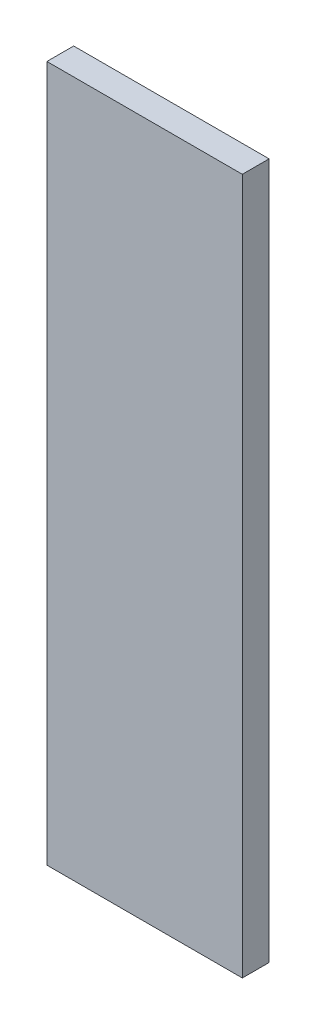
from build123d import *

# Parameters (mm, degrees)
SKETCH1_W           = 18.542
SKETCH1_H           = 66.04
BOSS_EXTRUDE1_DEPTH = 2.54


with BuildPart() as part:
    # Sketch1 → Boss-Extrude1 (new body)
    with BuildSketch(Plane.XY):
        with Locations((9.271, 33.02)):
            Rectangle(SKETCH1_W, SKETCH1_H)
    extrude(amount=BOSS_EXTRUDE1_DEPTH)


solid = part.part
